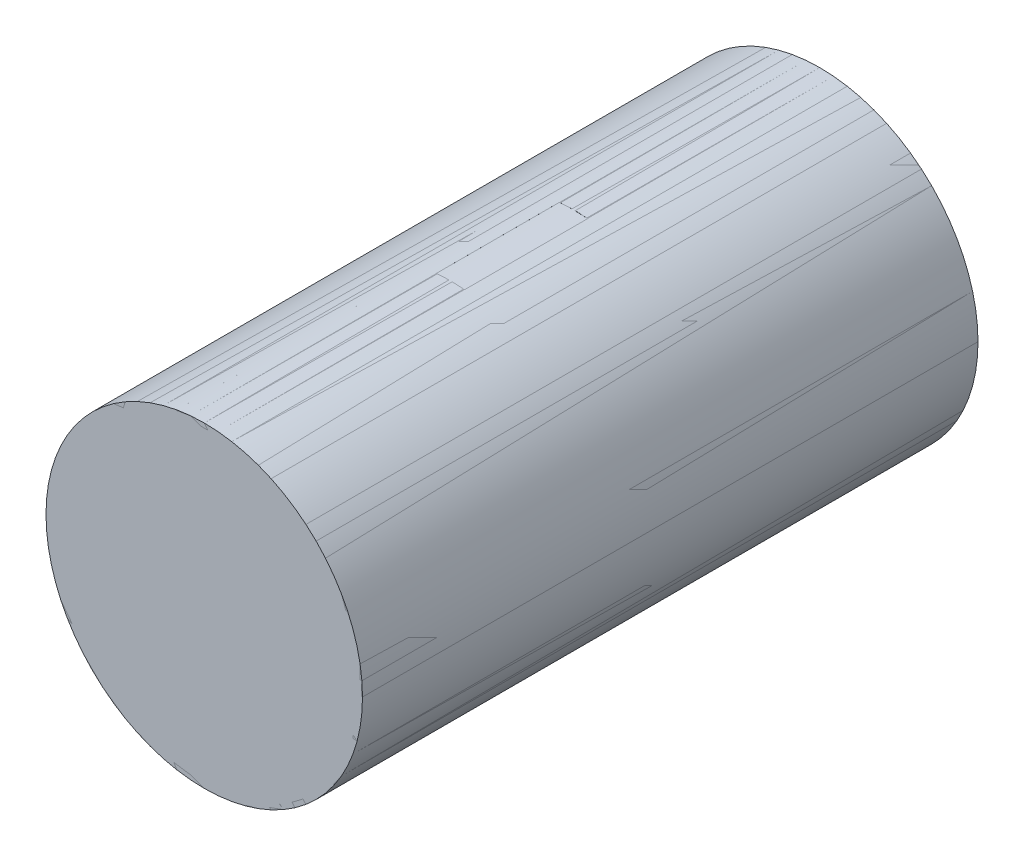
from build123d import *

# Parameters (mm, degrees)
SKETCH2_R               = 78.359
SKETCH2_R_2             = 76.2
BOSS_EXTRUDE1_DEPTH     = 304.8
CUT_EXTRUDE1_DEPTH      = 325.319758513
CUT_EXTRUDE1_DEPTH_BACK = 325.319758513
SKETCH3_W               = 13.9954
SKETCH3_H               = 60.96
SKETCH4_R               = 78.359
BOSS_EXTRUDE2_DEPTH     = 304.8


with BuildPart() as part:
    # Sketch2 → Boss-Extrude1 (new body)
    with BuildSketch(Plane.XY):
        with Locations(Location((0, 0, 0), (0, 0, 180))):
            Circle(SKETCH2_R)
        with Locations(Location((0, 0, 0), (0, 0, 180))):
            Circle(SKETCH2_R_2, mode=Mode.SUBTRACT)
    extrude(amount=BOSS_EXTRUDE1_DEPTH)

    # Sketch3 → Cut-Extrude1 (cut, two sides: drawn at the far end of the back side and taken through both)
    with BuildSketch(Plane(origin=(0, 0, 0), x_dir=(1, 0, 0), z_dir=(0, 1, 0)).offset(-CUT_EXTRUDE1_DEPTH_BACK)):
        with Locations((0, -152.4)):
            Rectangle(SKETCH3_W, SKETCH3_H)
    extrude(amount=CUT_EXTRUDE1_DEPTH + CUT_EXTRUDE1_DEPTH_BACK, mode=Mode.SUBTRACT)


with BuildPart() as body_2:
    # Sketch4 → Boss-Extrude2 (new, through all)
    with BuildSketch(Plane.XY.offset(304.8)):
        Circle(SKETCH4_R)
    extrude(amount=-BOSS_EXTRUDE2_DEPTH)


solid = Compound([part.part, body_2.part])
